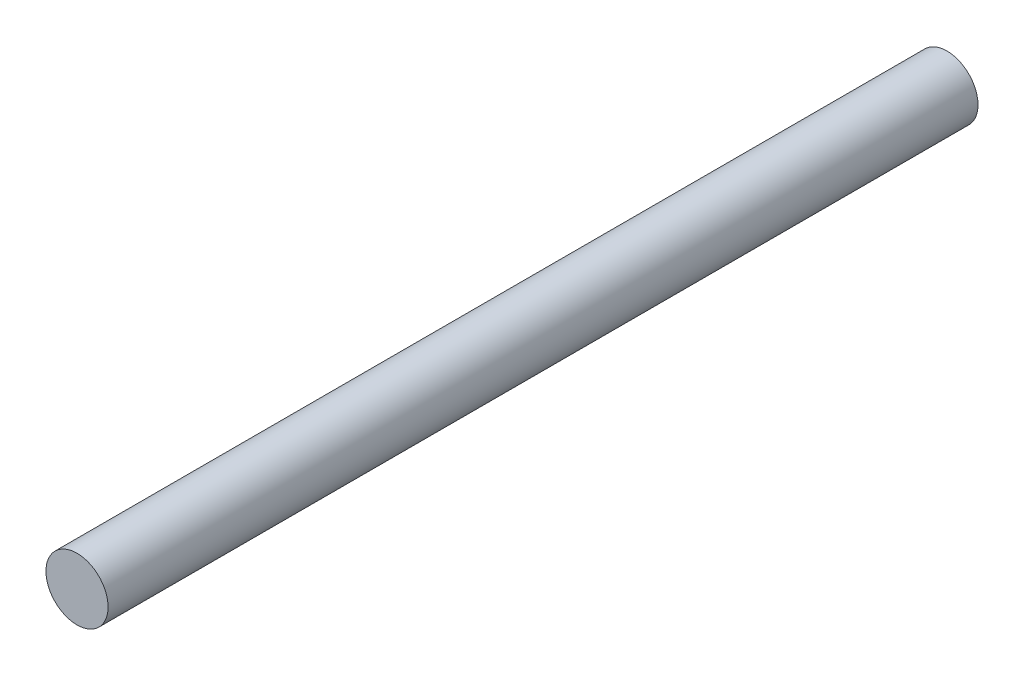
from build123d import *

# Parameters (mm, degrees)
SKETCH1_R           = 6.35
BOSS_EXTRUDE1_DEPTH = 177.8


with BuildPart() as part:
    # Sketch1 → Boss-Extrude1 (new body)
    with BuildSketch(Plane.XY):
        Circle(SKETCH1_R)
    extrude(amount=BOSS_EXTRUDE1_DEPTH)


solid = part.part
